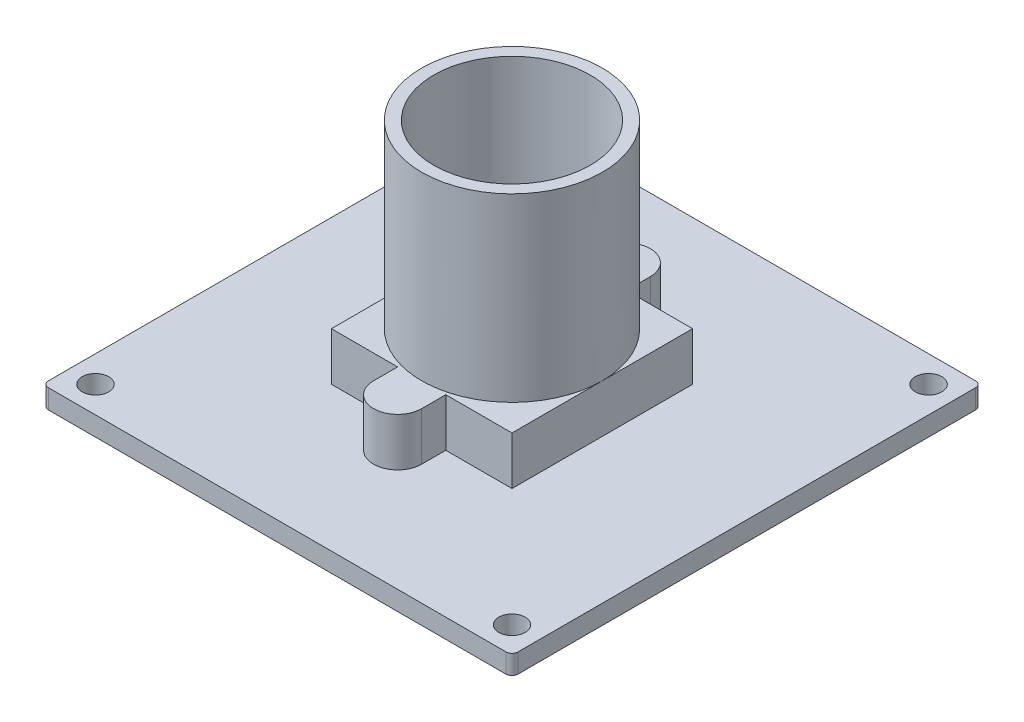
from build123d import *

# Parameters (mm, degrees)
SKETCH1_W                 = 39
SKETCH1_H                 = 39
BOSS_EXTRUDE1_DEPTH       = 0.8
FILLET1_R                 = 0.5
SKETCH2_R                 = 1.1
CUT_EXTRUDE1_DEPTH        = 1.6
SKETCH3_W                 = 7
SKETCH3_H                 = 7
BOSS_EXTRUDE2_DEPTH       = 2
SKETCH4_W                 = 14
SKETCH4_H                 = 14
BOSS_EXTRUDE3_DEPTH       = 4
SKETCH5_W                 = 15
SKETCH5_H                 = 15
BOSS_EXTRUDE4_DEPTH       = 0.1
SKETCH6_R                 = 7.5
BOSS_EXTRUDE5_DEPTH       = 15
M12_CLEARANCE_HOLE1_D     = 13
M12_CLEARANCE_HOLE1_DEPTH = 15.1


with BuildPart() as part:
    # Sketch1 → Boss-Extrude1 (new, symmetric)
    with BuildSketch(Plane(origin=(0, 0, 0), x_dir=(1, 0, 0), z_dir=(0, 1, 0))):
        Rectangle(SKETCH1_W, SKETCH1_H)
    extrude(amount=BOSS_EXTRUDE1_DEPTH, both=True)

    # Fillet1
    fillet1_edges = [part.edges().sort_by_distance(p)[0] for p in [
        (19.5, 0, 19.5),
        (-19.5, 0, 19.5),
        (-19.5, 0, -19.5),
        (19.5, 0, -19.5),
    ]]
    fillet(fillet1_edges, radius=FILLET1_R)

    # Sketch2 → Cut-Extrude1 (cut)
    with BuildSketch(Plane(origin=(0, 0.8, 0), x_dir=(1, 0, 0), z_dir=(0, 1, 0))):
        with Locations(Location((-17.3, 17.3, 0), (0, 0, 270))):
            Circle(SKETCH2_R)
        with Locations(Location((-17.3, -17.3, 0), (0, 0, 90))):
            Circle(SKETCH2_R)
        with Locations(Location((17.3, -17.3, 0), (0, 0, 270))):
            Circle(SKETCH2_R)
        with Locations(Location((17.3, 17.3, 0), (0, 0, 90))):
            Circle(SKETCH2_R)
    extrude(amount=-CUT_EXTRUDE1_DEPTH, mode=Mode.SUBTRACT)

    # Sketch3 → Boss-Extrude2 (add)
    with BuildSketch(Plane(origin=(0, 0.8, 0), x_dir=(1, 0, 0), z_dir=(0, 1, 0))):
        Rectangle(SKETCH3_W, SKETCH3_H)
    extrude(amount=BOSS_EXTRUDE2_DEPTH)

    # Sketch4 → Boss-Extrude3 (add)
    with BuildSketch(Plane(origin=(0, 0.8, 0), x_dir=(1, 0, 0), z_dir=(0, 1, 0))):
        with BuildLine():
            Line((-2, 9.5), (-2, 7.5))
            Line((-2, 7.5), (-7.5, 7.5))
            Line((-7.5, 7.5), (-7.5, -7.5))
            Line((-7.5, -7.5), (-2, -7.5))
            Line((-2, -7.5), (-2, -9.5))
            ThreePointArc((-2, -9.5), (0, -11.5), (2, -9.5))
            Line((2, -9.5), (2, -7.5))
            Line((2, -7.5), (7.5, -7.5))
            Line((7.5, -7.5), (7.5, 7.5))
            Line((7.5, 7.5), (2, 7.5))
            Line((2, 7.5), (2, 9.5))
            ThreePointArc((2, 9.5), (0, 11.5), (-2, 9.5))
        make_face()
        Rectangle(SKETCH4_W, SKETCH4_H, mode=Mode.SUBTRACT)
    extrude(amount=BOSS_EXTRUDE3_DEPTH)

    # Sketch5 → Boss-Extrude4 (add)
    with BuildSketch(Plane(origin=(0, 4.8, 0), x_dir=(1, 0, 0), z_dir=(0, 1, 0))):
        Rectangle(SKETCH5_W, SKETCH5_H)
    extrude(amount=-BOSS_EXTRUDE4_DEPTH)

    # Sketch6 → Boss-Extrude5 (add)
    with BuildSketch(Plane(origin=(0, 4.8, 0), x_dir=(1, 0, 0), z_dir=(0, 1, 0))):
        with Locations(Location((0, 0, 0), (0, 0, 180))):
            Circle(SKETCH6_R)
    extrude(amount=BOSS_EXTRUDE5_DEPTH)

    # M12 Clearance Hole1
    with Locations(Plane(origin=(0, 19.8, 0), x_dir=(1, 0, 0), z_dir=(0, 1, 0))):
        with Locations((0, 0)):
            Hole(M12_CLEARANCE_HOLE1_D / 2, depth=M12_CLEARANCE_HOLE1_DEPTH)


solid = part.part
